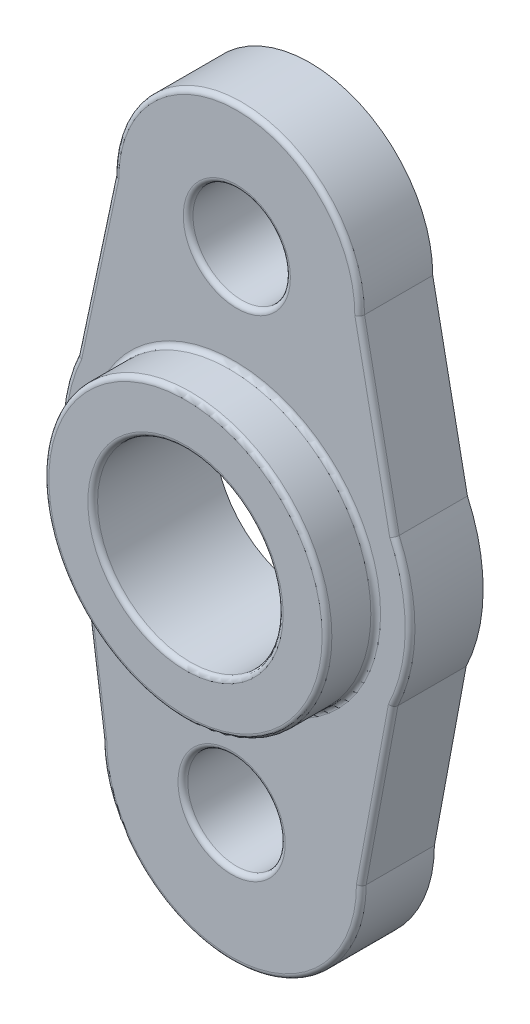
from build123d import *

# Parameters (mm, degrees)
SKETCH1_R           = 10
SKETCH1_R_2         = 19.05
BOSS_EXTRUDE1_DEPTH = 15
SKETCH2_R           = 29.05
SKETCH2_R_2         = 19.05
BOSS_EXTRUDE2_DEPTH = 10
FILLET2_R           = 1
FILLET3_R           = 1


with BuildPart() as part:
    # Sketch1 → Boss-Extrude1 (new body)
    with BuildSketch(Plane.XY):
        with BuildLine():
            Line((-24.155755476, 101.186951407), (-31.734621097, 65.543568739))
            ThreePointArc((-31.734621097, 65.543568739), (-35.02825175, 50.297571146), (-31.481386973, 35.108489681))
            Line((-31.481386973, 35.108489681), (-26.633262651, 0))
            ThreePointArc((-26.633262651, 0), (0, -26.633262651), (26.633262651, 0))
            Line((26.633262651, 0), (33.154025964, 35.108489681))
            ThreePointArc((33.154025964, 35.108489681), (36.641659251, 50.283356744), (33.415195598, 65.515891288))
            Line((33.415195598, 65.515891288), (26.296540608, 101.186951407))
            ThreePointArc((26.296540608, 101.186951407), (1.070392566, 126.413099449), (-24.155755476, 101.186951407))
        make_face()
        with Locations((1.070392566, 101.186951407)):
            Circle(SKETCH1_R, mode=Mode.SUBTRACT)
        Circle(SKETCH1_R, mode=Mode.SUBTRACT)
        with Locations((0.535196283, 50.593475704)):
            Circle(SKETCH1_R_2, mode=Mode.SUBTRACT)
    extrude(amount=BOSS_EXTRUDE1_DEPTH)

    # Sketch2 → Boss-Extrude2 (add)
    with BuildSketch(Plane.XY.offset(15)):
        with Locations((0.535196283, 50.593475704)):
            Circle(SKETCH2_R)
        with Locations((0.535196283, 50.593475704)):
            Circle(SKETCH2_R_2, mode=Mode.SUBTRACT)
    extrude(amount=BOSS_EXTRUDE2_DEPTH)

    # Fillet2
    fillet2_edges = [part.edges().sort_by_distance(p)[0] for p in [
        (-35.02825175, 50.297571146, 15),
        (-29.057324812, 17.554244841, 15),
        (0, -26.633262651, 15),
        (-8.929607434, 101.186951407, 15),
        (29.893644307, 17.554244841, 15),
        (-10, 0, 15),
        (36.641659251, 50.283356744, 15),
        (29.855868103, 83.351421348, 15),
        (-28.514803717, 50.593475704, 15),
        (1.070392566, 126.413099449, 15),
        (-27.945188286, 83.365260073, 15),
    ]]
    fillet(fillet2_edges, radius=FILLET2_R)

    # Fillet3
    fillet3_edges = [part.edges().sort_by_distance(p)[0] for p in [
        (-28.514803717, 50.593475704, 25),
        (-18.514803717, 50.593475704, 25),
    ]]
    fillet(fillet3_edges, radius=FILLET3_R)


solid = part.part
